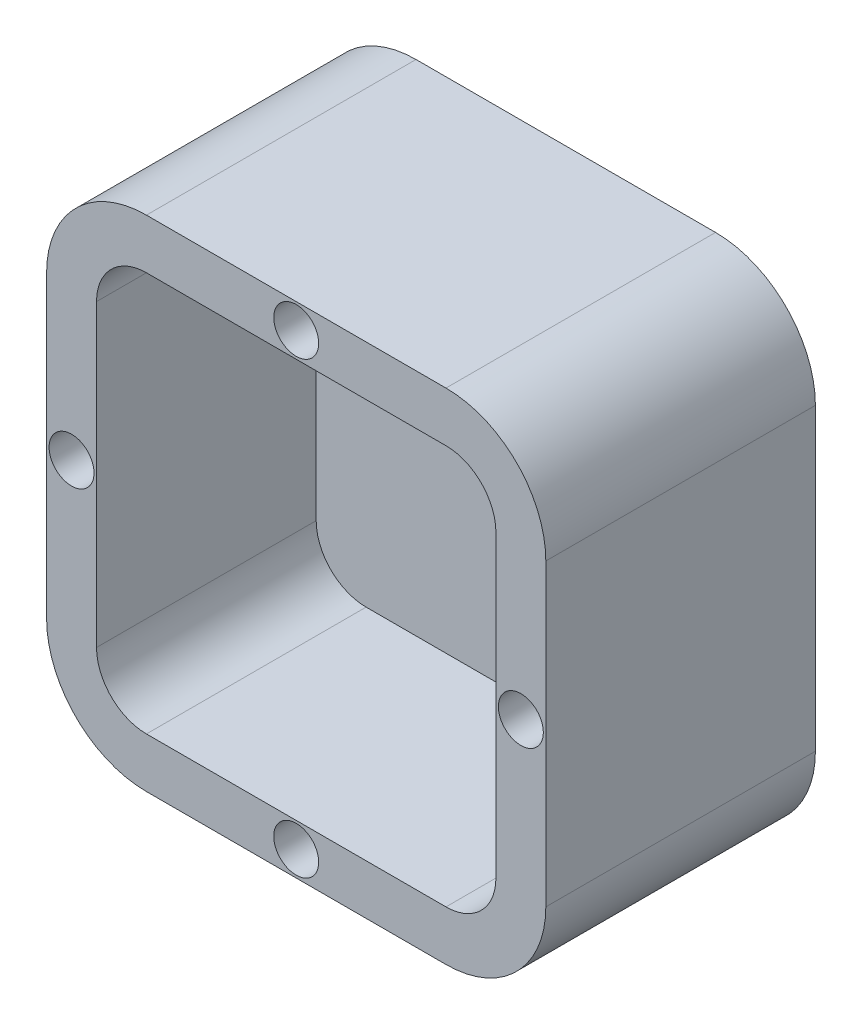
from build123d import *

# Parameters (mm, degrees)
SKETCH1_W           = 50
SKETCH1_H           = 50
BOSS_EXTRUDE1_DEPTH = 27
FILLET1_R           = 10
SHELL1_T            = -5
SKETCH3_R           = 1.55
CUT_EXTRUDE1_DEPTH  = 5
SKETCH4_R           = 2.25
CUT_EXTRUDE2_DEPTH  = 5


with BuildPart() as part:
    # Sketch1 → Boss-Extrude1 (new body)
    with BuildSketch(Plane.XY):
        with Locations((25, 25)):
            Rectangle(SKETCH1_W, SKETCH1_H)
    extrude(amount=BOSS_EXTRUDE1_DEPTH)

    # Fillet1
    fillet1_edges = [part.edges().sort_by_distance(p)[0] for p in [
        (0, 50, 13.5),
        (50, 50, 13.5),
        (50, 0, 13.5),
        (0, 0, 13.5),
    ]]
    fillet(fillet1_edges, radius=FILLET1_R)

    # Shell1
    shell1_openings = [part.faces().sort_by_distance(p)[0] for p in [
        (25, 25, 27),
    ]]
    offset(amount=SHELL1_T, openings=shell1_openings, kind=Kind.INTERSECTION)

    # Sketch3 → Cut-Extrude1 (cut)
    with BuildSketch(Plane.XY.offset(5)):
        with Locations((25, 32)):
            Circle(SKETCH3_R)
        with Locations((25, 18)):
            Circle(SKETCH3_R)
    extrude(amount=-CUT_EXTRUDE1_DEPTH, mode=Mode.SUBTRACT)

    # Sketch4 → Cut-Extrude2 (cut)
    with BuildSketch(Plane.XY.offset(27)):
        with Locations((25, 2.5)):
            Circle(SKETCH4_R)
        with Locations((2.5, 25)):
            Circle(SKETCH4_R)
        with Locations((25, 47.5)):
            Circle(SKETCH4_R)
        with Locations((47.5, 25)):
            Circle(SKETCH4_R)
    extrude(amount=-CUT_EXTRUDE2_DEPTH, mode=Mode.SUBTRACT)


solid = part.part
